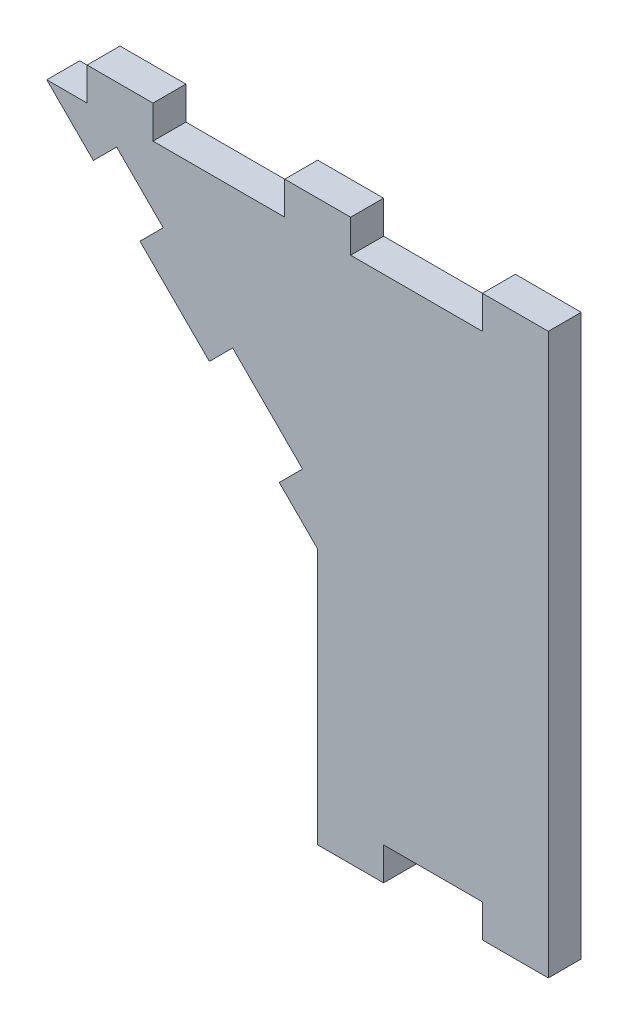
from build123d import *

# Parameters (mm, degrees)
BOSS_EXTRU_1_DEPTH = 5


with BuildPart() as part:
    # Esquisse1 → Boss.-Extru.1 (new body)
    with BuildSketch(Plane.XY):
        Polygon((-35, 33.881740674), (-40.833630945, 39.715371619), (-37.298097039, 43.250905525), (-47.904698757, 53.857507243), (-51.440232663, 50.321973337), (-61.976123702, 60.857864376), (-58.440589796, 64.393398282), (-65.511657608, 71.464466094), (-69.047191514, 67.928932188), (-76.118259326, 75), (-70, 75), (-70, 80), (-60, 80), (-60, 75), (-40, 75), (-40, 80), (-30, 80), (-30, 75), (-10, 75), (-10, 80), (0, 80), (0, 75), (0, 0), (0, -5), (-10, -5), (-10, 0), (-25, 0), (-25, -5), (-35, -5), (-35, 0), align=None)
    extrude(amount=BOSS_EXTRU_1_DEPTH)


solid = part.part
